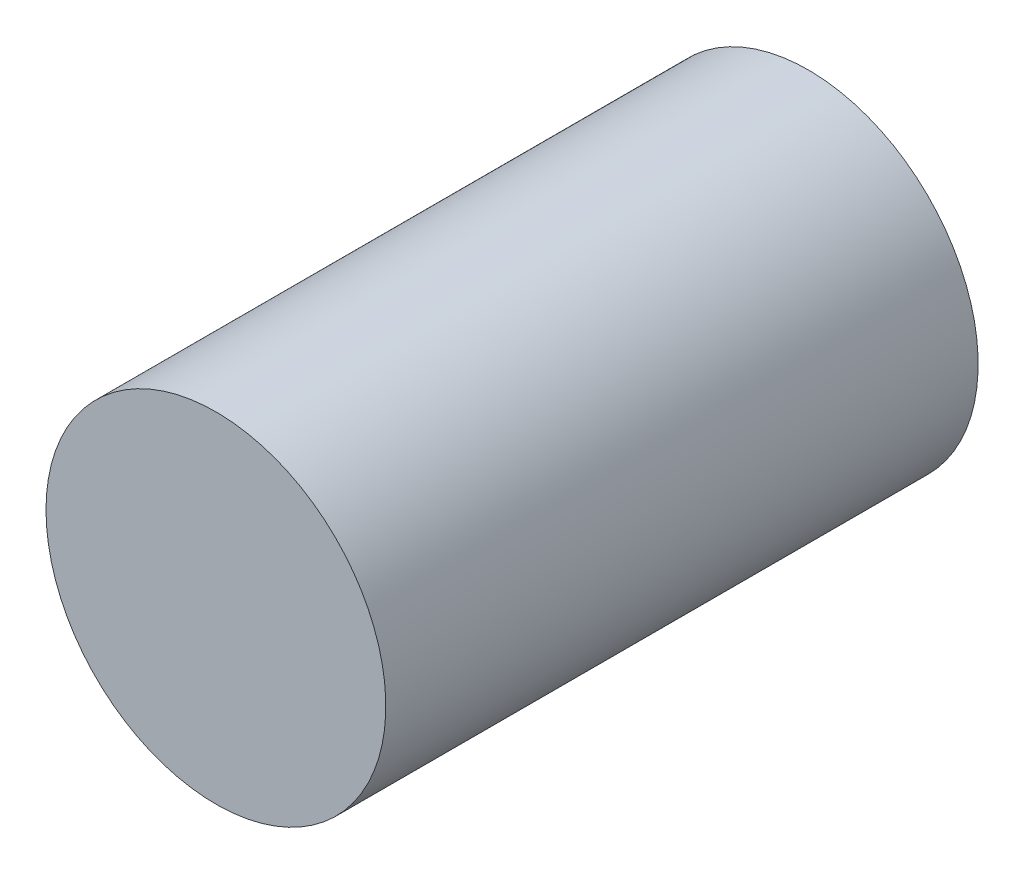
from build123d import *

# Parameters (mm, degrees)
SKETCH1_R           = 17.5006
BOSS_EXTRUDE1_DEPTH = 61.0108


with BuildPart() as part:
    # Sketch1 → Boss-Extrude1 (new body)
    with BuildSketch(Plane.XY):
        with Locations(Location((0, 0, 0), (0, 0, 180))):
            Circle(SKETCH1_R)
    extrude(amount=BOSS_EXTRUDE1_DEPTH)


solid = part.part
